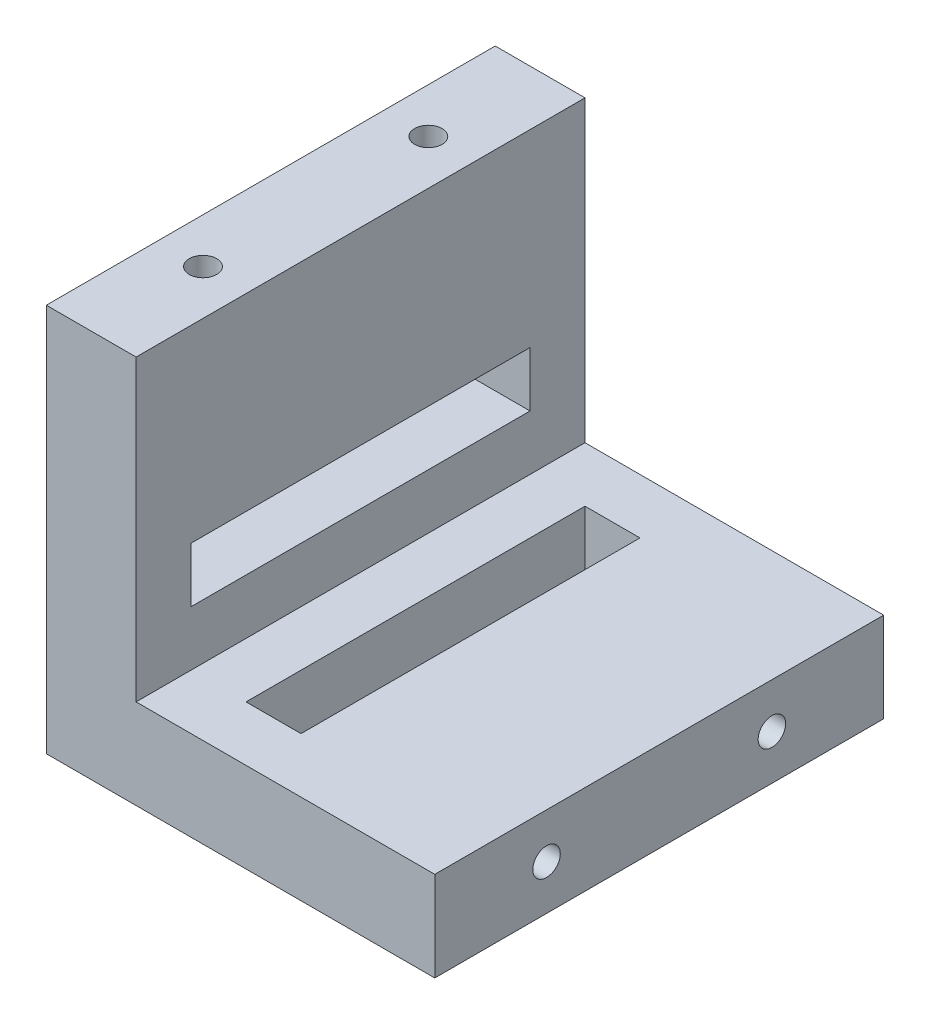
from build123d import *

# Parameters (mm, degrees)
EXTRUDE_1_DEPTH     = 24.5
SKETCH_2_R          = 0.75
CUT_EXTRUDE_1_DEPTH = 5
SKETCH_3_R          = 0.75
CUT_EXTRUDE_2_DEPTH = 5
SKETCH_4_W          = 3
SKETCH_4_H          = 18.5
CUT_EXTRUDE_3_DEPTH = 5
SKETCH_5_W          = 18.5
SKETCH_5_H          = 3
CUT_EXTRUDE_4_DEPTH = 5


with BuildPart() as part:
    # 草圖1 → 填料-伸長1 (new body)
    with BuildSketch(Plane.XY):
        Polygon((0, 0), (0, 21.2), (4.9, 21.2), (4.9, 4.9), (21.2, 4.9), (21.2, 0), align=None)
    extrude(amount=EXTRUDE_1_DEPTH)

    # 草圖2 → 除料-伸長1 (cut)
    with BuildSketch(Plane(origin=(21.2, 0, 0), x_dir=(0, 0, -1), z_dir=(1, 0, 0))):
        with Locations(Location((-6.1, 2.45, 0), (0, 0, 90))):
            Circle(SKETCH_2_R)
        with Locations(Location((-18.4, 2.45, 0), (0, 0, 90))):
            Circle(SKETCH_2_R)
    extrude(amount=-CUT_EXTRUDE_1_DEPTH, mode=Mode.SUBTRACT)

    # 草圖3 → 除料-伸長2 (cut)
    with BuildSketch(Plane(origin=(0, 21.2, 0), x_dir=(1, 0, 0), z_dir=(0, 1, 0))):
        with Locations(Location((2.45, -6.1, 0), (0, 0, 180))):
            Circle(SKETCH_3_R)
        with Locations(Location((2.45, -18.4, 0), (0, 0, 180))):
            Circle(SKETCH_3_R)
    extrude(amount=-CUT_EXTRUDE_2_DEPTH, mode=Mode.SUBTRACT)

    # 草圖4 → 除料-伸長3 (cut)
    with BuildSketch(Plane(origin=(0, 4.9, 0), x_dir=(-1, 0, 0), z_dir=(0, 1, 0))):
        with Locations((-9.4, 12.25)):
            Rectangle(SKETCH_4_W, SKETCH_4_H)
    extrude(amount=-CUT_EXTRUDE_3_DEPTH, mode=Mode.SUBTRACT)

    # 草圖5 → 除料-伸長4 (cut)
    with BuildSketch(Plane(origin=(4.9, 0, 0), x_dir=(0, 0, -1), z_dir=(1, 0, 0))):
        with Locations((-12.25, 9.4)):
            Rectangle(SKETCH_5_W, SKETCH_5_H)
    extrude(amount=-CUT_EXTRUDE_4_DEPTH, mode=Mode.SUBTRACT)


solid = part.part
